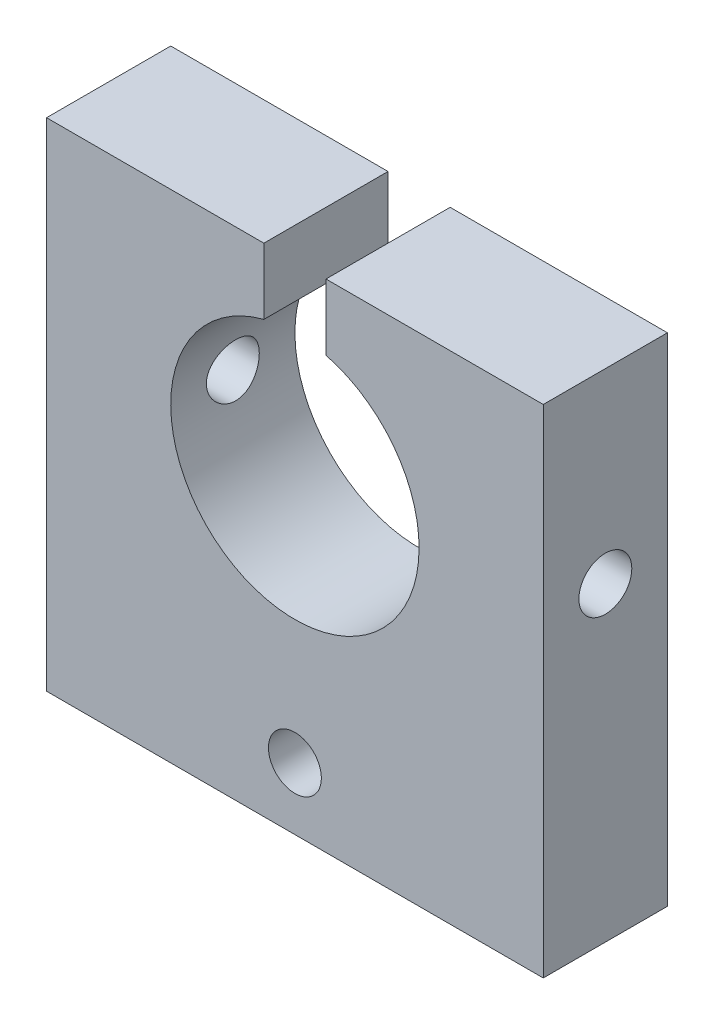
from build123d import *

# Parameters (mm, degrees)
SKETCH1_W             = 25.4
SKETCH1_H             = 25.4
BOSS_EXTRUDE1_DEPTH   = 6.35
CUT_EXTRUDE1_DEPTH    = 20.05
F_6_32_TAPPED_HOLE1_D = 2.7051
F_6_32_TAPPED_HOLE2_D = 2.7051


with BuildPart() as part:
    # Sketch1 → Boss-Extrude1 (new body)
    with BuildSketch(Plane.XY):
        Rectangle(SKETCH1_W, SKETCH1_H)
    extrude(amount=BOSS_EXTRUDE1_DEPTH)

    # Sketch2 → Cut-Extrude1 (cut, through all)
    with BuildSketch(Plane.XY.offset(6.35)):
        with BuildLine():
            Line((-1.5875, 9.323361062), (-1.5875, 1.740204949))
            Line((-1.5875, 1.740204949), (1.5875, 1.740204949))
            Line((1.5875, 1.740204949), (1.5875, 9.323361062))
            ThreePointArc((1.5875, 9.323361062), (0, 9.525), (-1.5875, 9.323361062))
        make_face()
        with BuildLine():
            Line((1.5875, 1.740204949), (-1.5875, 1.740204949))
            Line((-1.5875, 1.740204949), (-1.5875, 9.323361062))
            ThreePointArc((-1.5875, 9.323361062), (-3.888564967, -1.845115786), (6.35, 3.175))
            ThreePointArc((6.35, 3.175), (5.020115786, 7.063564967), (1.5875, 9.323361062))
            Line((1.5875, 9.323361062), (1.5875, 1.740204949))
        make_face()
        with BuildLine():
            Line((-1.5875, 12.7), (-1.5875, 9.323361062))
            ThreePointArc((-1.5875, 9.323361062), (0, 9.525), (1.5875, 9.323361062))
            Line((1.5875, 9.323361062), (1.5875, 12.7))
            Line((1.5875, 12.7), (-1.5875, 12.7))
        make_face()
    extrude(amount=-CUT_EXTRUDE1_DEPTH, mode=Mode.SUBTRACT)

    # #6-32 Tapped Hole1 (through all)
    with Locations(Plane(origin=(12.7, 0, 0), x_dir=(0, 0, -1), z_dir=(1, 0, 0))):
        with Locations((-3.175, 3.175)):
            Hole(F_6_32_TAPPED_HOLE1_D / 2)

    # #6-32 Tapped Hole2 (through all)
    with Locations(Plane.XY.offset(6.35)):
        with Locations((0, -9.525)):
            Hole(F_6_32_TAPPED_HOLE2_D / 2)


solid = part.part
